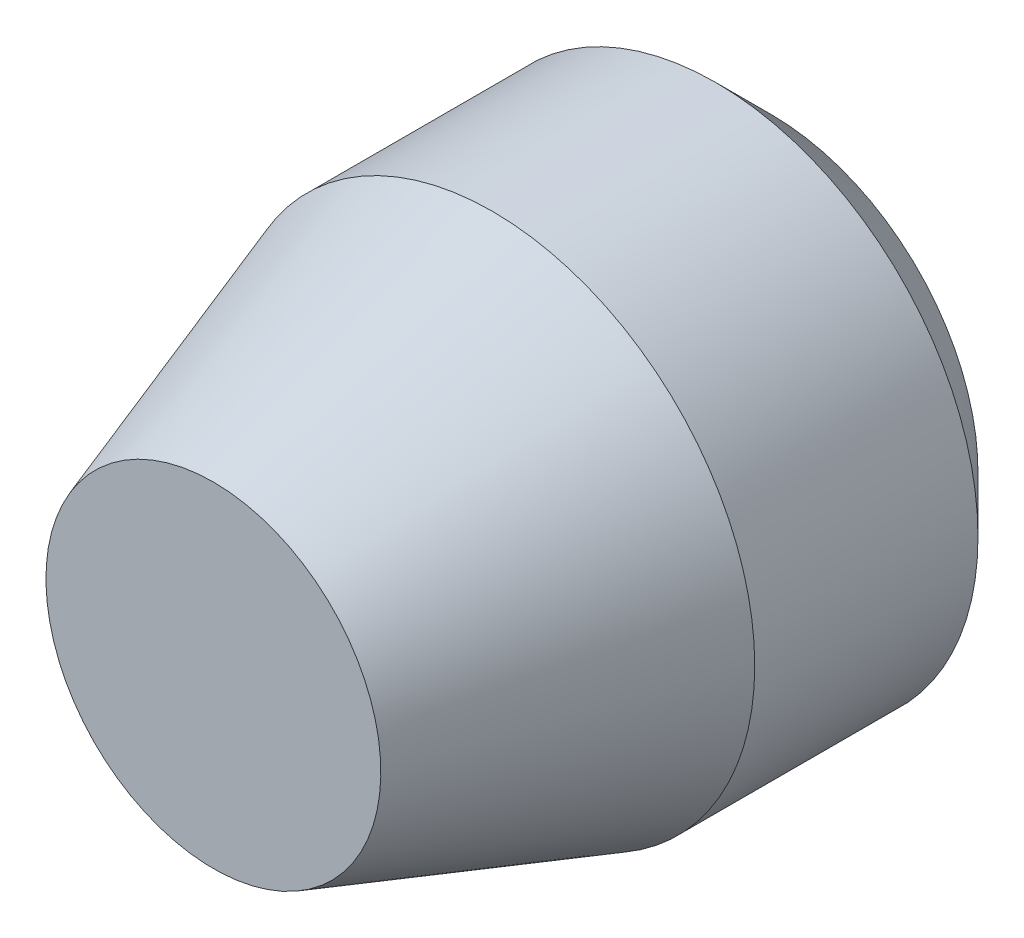
from build123d import *

# Parameters (mm, degrees)
CHANFRO1_SIZE = 1


with BuildPart() as part:
    # Esboço3 → Revolução1 (revolve)
    with BuildSketch(Plane(origin=(0, 0, 0), x_dir=(0, 0, -1), z_dir=(1, 0, 0))):
        Polygon((0, 0), (0, 3), (5, 4.7), (10, 4.7), (10, 0), align=None)
    revolve(axis=Axis((0, 0, -10), (0, 0, 1)))

    # Chanfro1
    chanfro1_edges = [part.edges().sort_by_distance(p)[0] for p in [
        (0, -4.7, -10),
    ]]
    chamfer(chanfro1_edges, length=CHANFRO1_SIZE)


solid = part.part
